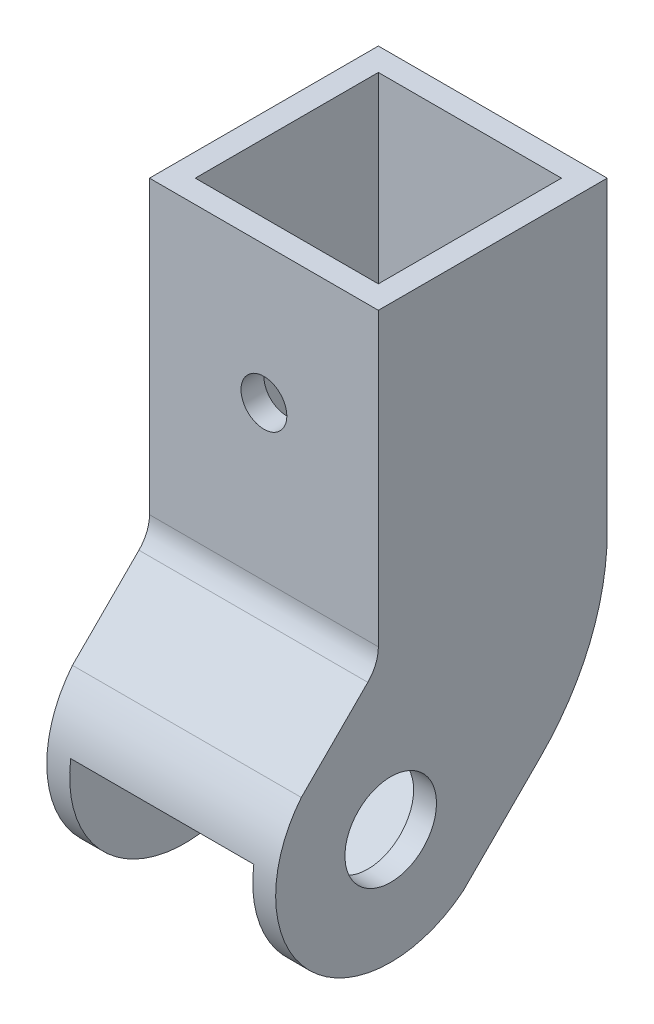
from build123d import *

# Parameters (mm, degrees)
BOSS_EXTRUDE1_DEPTH = 31.75
CUT_EXTRUDE2_START  = -3.175
CUT_EXTRUDE2_DEPTH  = 25.4
SKETCH4_W           = 25.4
SKETCH4_H           = 25.4
CUT_EXTRUDE3_DEPTH  = 3.175
SKETCH6_W           = 25.4
SKETCH6_H           = 25.4
CUT_EXTRUDE5_DEPTH  = 3.175
FILLET1_R           = 5
CUT_EXTRUDE6_REACH  = 79.895
SKETCH8_R           = 3.175
CUT_EXTRUDE7_REACH  = 69.69
SKETCH9_R           = 6.35
CUT_EXTRUDE8_DEPTH  = 68.689586975


with BuildPart() as part:
    # Sketch1 → Boss-Extrude1 (new body)
    with BuildSketch(Plane(origin=(0, 0, 0), x_dir=(0, 0, -1), z_dir=(1, 0, 0))):
        with BuildLine():
            Line((15.875, 42.5), (-15.875, 42.5))
            Line((-15.875, 42.5), (-15.875, 0))
            Line((-15.875, 0), (-38.855970389, -22.980970389))
            Line((-38.855970389, -22.980970389), (-16.405330086, -45.431610691))
            Line((-16.405330086, -45.431610691), (6.575640303, -22.450640303))
            ThreePointArc((6.575640303, -22.450640303), (13.458175157, -12.150198978), (15.875, 0))
            Line((15.875, 0), (15.875, 42.5))
        make_face()
    extrude(amount=BOSS_EXTRUDE1_DEPTH)

    # Sketch3 → Cut-Extrude2 (cut)
    with BuildSketch(Plane.ZY.offset(CUT_EXTRUDE2_START)):
        with BuildLine():
            Line((16.405330086, -40.941482631), (34.365842328, -22.980970389))
            Line((34.365842328, -22.980970389), (12.7, -1.315128061))
            Line((12.7, -1.315128061), (12.7, 39.325))
            Line((12.7, 39.325), (-12.7, 39.325))
            Line((-12.7, 39.325), (-12.7, 0))
            ThreePointArc((-12.7, 0), (-10.524857642, -10.93517908), (-4.330576272, -20.205576272))
            Line((-4.330576272, -20.205576272), (16.405330086, -40.941482631))
        make_face()
    extrude(amount=-CUT_EXTRUDE2_DEPTH, mode=Mode.SUBTRACT)

    # Sketch4 → Cut-Extrude3 (cut)
    with BuildSketch(Plane(origin=(0, 42.5, 0), x_dir=(1, 0, 0), z_dir=(0, 1, 0))):
        with Locations((15.875, 0)):
            Rectangle(SKETCH4_W, SKETCH4_H)
    extrude(amount=-CUT_EXTRUDE3_DEPTH, mode=Mode.SUBTRACT)

    # Sketch6 → Cut-Extrude5 (cut)
    with BuildSketch(Plane(origin=(0, -30.918470389, 30.918470389), x_dir=(1, 0, 0), z_dir=(0, -0.7071067811865518, 0.7071067811865434))):
        with Locations((15.875, -4.649679849)):
            Rectangle(SKETCH6_W, SKETCH6_H)
    extrude(amount=-CUT_EXTRUDE5_DEPTH, mode=Mode.SUBTRACT)

    # Fillet1
    fillet1_edges = [part.edges().sort_by_distance(p)[0] for p in [
        (15.875, 0, 15.875),
        (15.875, -1.315128061, 12.7),
    ]]
    fillet(fillet1_edges, radius=FILLET1_R)

    # Cut-Extrude6: up to this face of the body (flat: up to its plane)
    cut_extrude6_end = Plane(part.part.faces().sort_by_distance((15.875, 22.285533906, 15.875))[0])
    # Sketch8 → Cut-Extrude6 (cut, up to the picked face)
    with BuildSketch(Plane(origin=(0, 0, -15.875), x_dir=(-1, 0, 0), z_dir=(0, 0, -1)), mode=Mode.PRIVATE) as cut_extrude6_sk1:
        with Locations((-15.875, 23.45)):
            Circle(SKETCH8_R)
    cut_extrude6_tool1 = split(extrude(cut_extrude6_sk1.sketch, amount=-CUT_EXTRUDE6_REACH, mode=Mode.PRIVATE), bisect_by=cut_extrude6_end, keep=Keep.BOTH, mode=Mode.PRIVATE)
    add(cut_extrude6_tool1.solids().sort_by(Axis((15.875, 23.45, -15.875), (0, 0, 1)))[0], mode=Mode.SUBTRACT)

    # Cut-Extrude7: up to this face of the body (flat: up to its plane)
    cut_extrude7_end = Plane(part.part.faces().sort_by_distance((0, 0.759502888, 5.54562078))[0])
    # Sketch9 → Cut-Extrude7 (cut, up to the picked face)
    with BuildSketch(Plane(origin=(31.75, 0, 0), x_dir=(0, 0, -1), z_dir=(1, 0, 0)), mode=Mode.PRIVATE) as cut_extrude7_sk1:
        with Locations(Location((-14.160266056, -20.735906358, 0), (0, 0, 180))):
            Circle(SKETCH9_R)
    cut_extrude7_tool1 = split(extrude(cut_extrude7_sk1.sketch, amount=-CUT_EXTRUDE7_REACH, mode=Mode.PRIVATE), bisect_by=cut_extrude7_end, keep=Keep.BOTH, mode=Mode.PRIVATE)
    add(cut_extrude7_tool1.solids().sort_by(Axis((31.75, -20.735906, 14.160266), (-1, 0, 0)))[0], mode=Mode.SUBTRACT)

    # Sketch11 → Cut-Extrude8 (cut, through all)
    with BuildSketch(Plane(origin=(31.75, 0, 0), x_dir=(0, 0, -1), z_dir=(1, 0, 0))):
        with BuildLine():
            ThreePointArc((-4.10994949, -33.136230095), (-25.446915068, -32.022555371), (-26.560589793, -10.685589793))
            Line((-26.560589793, -10.685589793), (-38.855970389, -22.980970389))
            Line((-38.855970389, -22.980970389), (-16.405330086, -45.431610691))
            Line((-16.405330086, -45.431610691), (-4.10994949, -33.136230095))
        make_face()
    extrude(amount=-CUT_EXTRUDE8_DEPTH, mode=Mode.SUBTRACT)


solid = part.part
